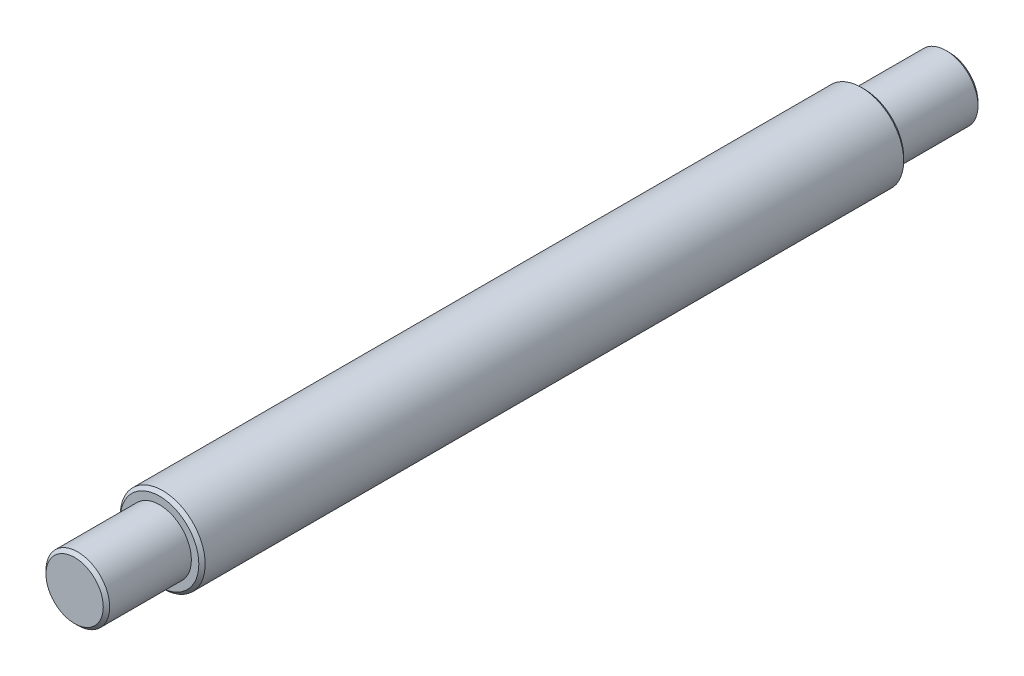
from build123d import *

# Parameters (mm, degrees)
SKETCH1_R           = 4
BOSS_EXTRUDE1_DEPTH = 33.2
SKETCH2_R           = 3
BOSS_EXTRUDE2_DEPTH = 8
CHAMFER1_SIZE       = 0.3


with BuildPart() as part:
    # Sketch1 → Boss-Extrude1 (new, symmetric)
    with BuildSketch(Plane.XY):
        with Locations(Location((0, 0, 0), (0, 0, 180))):
            Circle(SKETCH1_R)
    extrude(amount=BOSS_EXTRUDE1_DEPTH, both=True)

    # Sketch2 → Boss-Extrude2 (add)
    with BuildSketch(Plane.XY.offset(33.2)):
        Circle(SKETCH2_R)
    boss_extrude2 = extrude(amount=BOSS_EXTRUDE2_DEPTH)

    # Mirror1: Boss-Extrude2 across plane
    add(boss_extrude2.mirror(Plane.XY))

    # Chamfer1
    chamfer1_edges = [part.edges().sort_by_distance(p)[0] for p in [
        (-3, 0, -41.2),
        (4, 0, -33.2),
        (4, 0, 33.2),
        (-3, 0, 41.2),
    ]]
    chamfer(chamfer1_edges, length=CHAMFER1_SIZE)


solid = part.part
